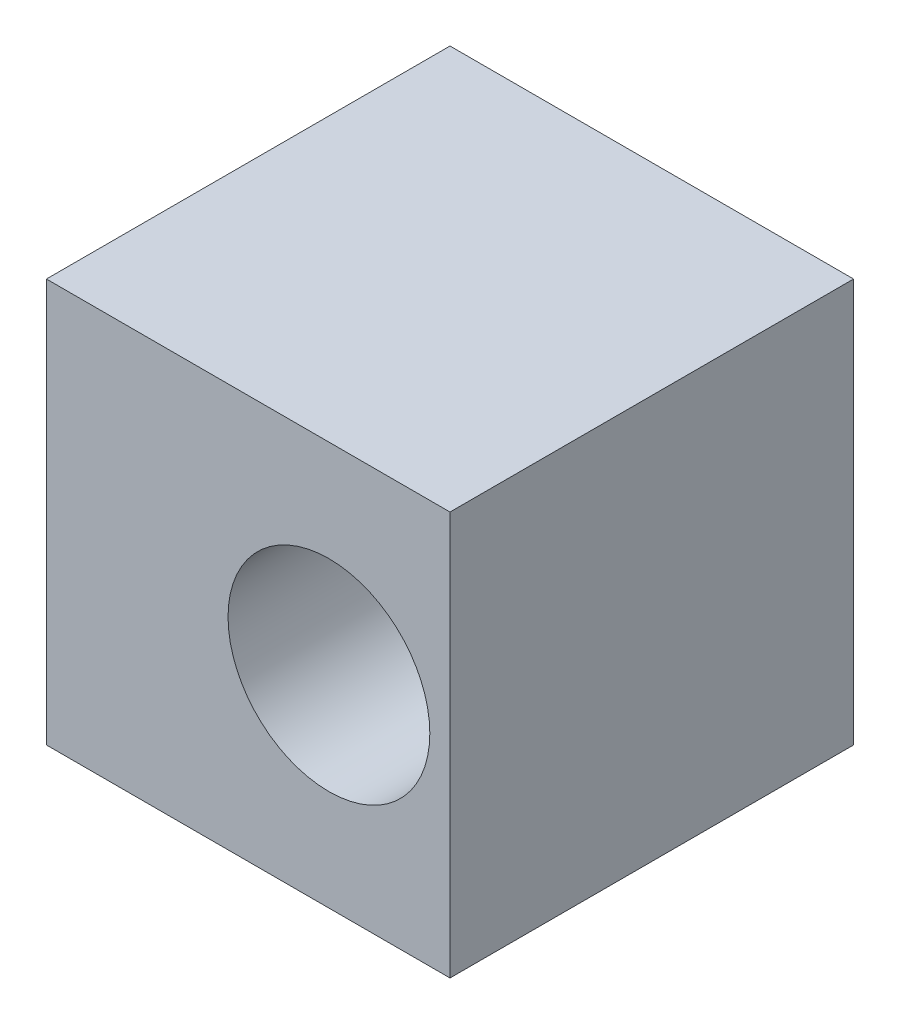
from build123d import *

# Parameters (mm, degrees)
SKETCH1_W           = 10
SKETCH1_H           = 10
BOSS_EXTRUDE1_DEPTH = 10
SKETCH2_R           = 2.5
CUT_EXTRUDE2_DEPTH  = 18.320508076


with BuildPart() as part:
    # Sketch1 → Boss-Extrude1 (new body)
    with BuildSketch(Plane.XY):
        with Locations((5, 5)):
            Rectangle(SKETCH1_W, SKETCH1_H)
    extrude(amount=BOSS_EXTRUDE1_DEPTH)

    # Sketch2 → Cut-Extrude2 (cut, through all)
    with BuildSketch(Plane.XY):
        with Locations((7, 5)):
            Circle(SKETCH2_R)
    extrude(amount=CUT_EXTRUDE2_DEPTH, mode=Mode.SUBTRACT)


solid = part.part
